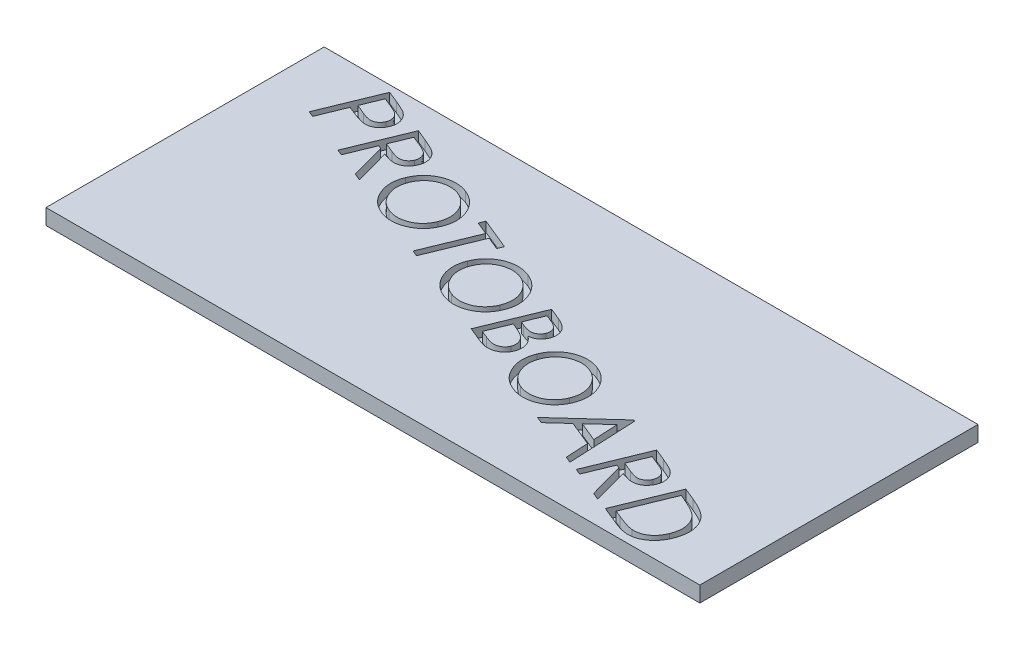
from build123d import *

# Parameters (mm, degrees)
SKETCH1_W           = 67
SKETCH1_H           = 28.5
BOSS_EXTRUDE1_DEPTH = 0.8
CUT_EXTRUDE1_DEPTH  = 1


with BuildPart() as part:
    # Sketch1 → Boss-Extrude1 (new, symmetric)
    with BuildSketch(Plane(origin=(0, 0, 0), x_dir=(1, 0, 0), z_dir=(0, 1, 0))):
        Rectangle(SKETCH1_W, SKETCH1_H)
    extrude(amount=BOSS_EXTRUDE1_DEPTH, both=True)

    # Sketch2 → Cut-Extrude1 (cut)
    # profile 1 of 10: a face of its own
    with BuildSketch(Plane(origin=(0, 0.8, 0), x_dir=(1, 0, 0), z_dir=(0, 1, 0))):
        with BuildLine():
            Line((-26.114085123, 13.586830104), (-24.948900828, 13.108544848))
            add(Edge.make_bspline(
                [(-24.948900828, 13.108544848), (-24.869114448, 13.075647807), (-24.715929476, 13.0124875), (-24.497576983, 12.919199351), (-24.301396267, 12.8292771), (-24.12559593, 12.74753227), (-23.971876498, 12.669806272), (-23.839106738, 12.598922442), (-23.727613695, 12.533683708), (-23.663044261, 12.488178388), (-23.633616373, 12.467439079)],
                knots=[0, 0, 0, 0, 1.413041787, 2.71295386, 3.88734424, 4.946346486, 5.887083026, 6.707106444, 7.410756401, 8, 8, 8, 8], degree=3))
            add(Edge.make_bspline(
                [(-23.633616373, 12.467439079), (-23.597107982, 12.439602786), (-23.524792957, 12.384465264), (-23.425777499, 12.292767117), (-23.336553974, 12.195052712), (-23.254081782, 12.093801008), (-23.183169674, 11.984333418), (-23.119125991, 11.870528143), (-23.065648057, 11.74982206), (-23.021326213, 11.624395662), (-22.986670014, 11.495271746), (-22.964749802, 11.363198666), (-22.956500351, 11.229044628), (-22.958097157, 11.092710072), (-22.975927669, 10.954557594), (-23.003744913, 10.8141324), (-23.044213364, 10.671435348), (-23.080769544, 10.577767628), (-23.099361566, 10.530129383)],
                knots=[0, 0, 0, 0, 1.010908045, 2.002384629, 2.967464651, 3.924374345, 4.875110215, 5.83674901, 6.798387805, 7.779159755, 8.764679086, 9.739741565, 10.722646018, 11.722228584, 12.738258453, 13.786034335, 14.874004436, 16, 16, 16, 16], degree=3))
            add(Edge.make_bspline(
                [(-23.099361566, 10.530129383), (-23.119855636, 10.482730008), (-23.159857643, 10.390212025), (-23.23077677, 10.259370139), (-23.307870192, 10.138848804), (-23.392136787, 10.027825025), (-23.485435569, 9.929471339), (-23.5836504, 9.839051009), (-23.689886174, 9.759986923), (-23.802743044, 9.691381333), (-23.921521695, 9.63434982), (-24.044392844, 9.587014818), (-24.171366878, 9.549338134), (-24.303363123, 9.526530979), (-24.438375638, 9.510127271), (-24.577932272, 9.507337793), (-24.72173478, 9.512776753), (-24.818382572, 9.526089409), (-24.867490572, 9.532853742)],
                knots=[0, 0, 0, 0, 1.12058794, 2.187255352, 3.226443411, 4.224288402, 5.207636086, 6.165494607, 7.119097929, 8.077310197, 9.028288897, 9.975294659, 10.933683753, 11.897758049, 12.879683058, 13.883369639, 14.924512591, 16, 16, 16, 16], degree=3))
            add(Edge.make_bspline(
                [(-24.867490572, 9.532853742), (-24.907463955, 9.53995503), (-24.994844998, 9.555478308), (-25.134246092, 9.593102841), (-25.29501604, 9.638169954), (-25.475580911, 9.69729878), (-25.676010008, 9.769316489), (-25.897905383, 9.850140814), (-26.1392454, 9.944846378), (-26.306654211, 10.012668778), (-26.39393288, 10.048028021)],
                knots=[0, 0, 0, 0, 0.603576257, 1.319406048, 2.145814691, 3.087144917, 4.144297245, 5.313491875, 6.59938763, 8, 8, 8, 8], degree=3))
            Line((-26.39393288, 10.048028021), (-26.811160444, 10.218480745))
            Line((-26.811160444, 10.218480745), (-27.926735364, 7.498869367))
            Line((-27.926735364, 7.498869367), (-28.511871582, 7.739284031))
            Line((-28.511871582, 7.739284031), (-26.114085123, 13.586830104))
        make_face()
        with BuildLine():
            Line((-25.761731357, 12.777815681), (-26.577105957, 10.790896611))
            Line((-26.577105957, 10.790896611), (-25.592550668, 10.372397011))
            add(Edge.make_bspline(
                [(-25.592550668, 10.372397011), (-25.543818791, 10.35325082), (-25.450008687, 10.316393915), (-25.313794416, 10.26411944), (-25.1846905, 10.222940966), (-25.06508472, 10.186480824), (-24.953549452, 10.160232612), (-24.851504995, 10.1389954), (-24.757573001, 10.126071135), (-24.644928239, 10.119204421), (-24.512523255, 10.126079206), (-24.361735234, 10.16015425), (-24.218664703, 10.215256596), (-24.084976092, 10.292834256), (-23.965297736, 10.391457471), (-23.857535914, 10.503274362), (-23.770309584, 10.634182056), (-23.726081216, 10.729618999), (-23.703578312, 10.778176258)],
                knots=[0, 0, 0, 0, 1.141095427, 2.196637768, 3.178462605, 4.093627622, 4.920623417, 5.674488624, 6.364487568, 6.984691394, 8.132315414, 9.239805528, 10.339753057, 11.461833926, 12.591800851, 13.709574146, 14.83465671, 16, 16, 16, 16], degree=3))
            add(Edge.make_bspline(
                [(-23.703578312, 10.778176258), (-23.685472249, 10.826906622), (-23.649633911, 10.92336134), (-23.623626563, 11.075611389), (-23.619503457, 11.22947231), (-23.63923224, 11.382663486), (-23.677800507, 11.530555792), (-23.736579359, 11.66870615), (-23.81645228, 11.793881906), (-23.90099364, 11.886713881), (-23.979890021, 11.958118452), (-24.053203186, 12.010827597), (-24.13769131, 12.065226659), (-24.232177547, 12.123041352), (-24.3403942, 12.177953478), (-24.458597598, 12.237144854), (-24.58922242, 12.29667281), (-24.681222499, 12.334598727), (-24.728838729, 12.354227941)],
                knots=[0, 0, 0, 0, 1.160691685, 2.297421559, 3.435891004, 4.592273535, 5.740224324, 6.844848026, 7.936694453, 9.044895366, 9.642706144, 10.314217422, 11.061311598, 11.89084748, 12.790205491, 13.774242598, 14.848020821, 16, 16, 16, 16], degree=3))
            Line((-24.728838729, 12.354227941), (-25.761731357, 12.777815681))
        make_face(mode=Mode.SUBTRACT)
    # profile 2 of 10: a face of its own
    with BuildSketch(Plane(origin=(0, 0.8, 0), x_dir=(1, 0, 0), z_dir=(0, 1, 0))):
        with BuildLine():
            Line((-21.237185999, 11.647023828), (-20.072001705, 11.168738572))
            add(Edge.make_bspline(
                [(-20.072001705, 11.168738572), (-19.994356534, 11.136639901), (-19.845090939, 11.074933203), (-19.63210157, 10.984543568), (-19.440763415, 10.896774652), (-19.269055863, 10.817908151), (-19.11833854, 10.742239732), (-18.988174558, 10.673356084), (-18.87840118, 10.609641556), (-18.814191883, 10.56651868), (-18.784702025, 10.546713331)],
                knots=[0, 0, 0, 0, 1.408253262, 2.707235473, 3.877690773, 4.93644646, 5.874040804, 6.703871718, 7.404717994, 8, 8, 8, 8], degree=3))
            add(Edge.make_bspline(
                [(-18.784702025, 10.546713331), (-18.746502518, 10.518462034), (-18.671341566, 10.462875075), (-18.567732031, 10.370324538), (-18.473260113, 10.272155975), (-18.387633997, 10.167881166), (-18.312603984, 10.056984442), (-18.247410468, 9.940250248), (-18.19094928, 9.817998819), (-18.14592211, 9.689630547), (-18.109446598, 9.55859164), (-18.088408129, 9.424577971), (-18.077754221, 9.289719977), (-18.080470394, 9.152557901), (-18.096185062, 9.014363957), (-18.122686779, 8.87413478), (-18.163835815, 8.733155133), (-18.19933922, 8.640124857), (-18.217374301, 8.592867177)],
                knots=[0, 0, 0, 0, 1.031596047, 2.02975762, 3.013365459, 3.988658774, 4.956837365, 5.917627858, 6.890264702, 7.877831776, 8.869812723, 9.840397818, 10.8194674, 11.805142911, 12.815132457, 13.837518562, 14.901498957, 16, 16, 16, 16], degree=3))
            add(Edge.make_bspline(
                [(-18.217374301, 8.592867177), (-18.251835253, 8.516757685), (-18.31917837, 8.368025566), (-18.452247684, 8.166740348), (-18.605949508, 7.990004006), (-18.781555193, 7.840747252), (-18.976952193, 7.721407144), (-19.188226298, 7.632628611), (-19.415411504, 7.578094576), (-19.614499562, 7.559399426), (-19.781791302, 7.560900522), (-19.916523938, 7.572837671), (-20.0586344, 7.59505382), (-20.209065454, 7.625377072), (-20.366325894, 7.666592121), (-20.531412715, 7.716552507), (-20.704224965, 7.776121772), (-20.820983611, 7.822392148), (-20.881016128, 7.846182482)],
                knots=[0, 0, 0, 0, 1.273303662, 2.488272424, 3.666698826, 4.837354516, 5.990352788, 7.147573616, 8.319873285, 9.541885801, 10.188965819, 10.870857056, 11.603850976, 12.382999543, 13.211624861, 14.083628126, 15.014680029, 16, 16, 16, 16], degree=3))
            Line((-20.881016128, 7.846182482), (-19.893916769, 4.2641312))
            Line((-19.893916769, 4.2641312), (-20.61770483, 4.56178745))
            Line((-20.61770483, 4.56178745), (-21.600988083, 8.141294661))
            Line((-21.600988083, 8.141294661), (-21.93426132, 8.278674469))
            Line((-21.93426132, 8.278674469), (-23.04983624, 5.559063091))
            Line((-23.04983624, 5.559063091), (-23.634972458, 5.799477754))
            Line((-23.634972458, 5.799477754), (-21.237185999, 11.647023828))
        make_face()
        with BuildLine():
            Line((-20.886104269, 10.834193299), (-21.701478868, 8.846002193))
            Line((-21.701478868, 8.846002193), (-20.700387121, 8.426230559))
            add(Edge.make_bspline(
                [(-20.700387121, 8.426230559), (-20.652963057, 8.407403254), (-20.561395456, 8.37105101), (-20.42764314, 8.321139402), (-20.30199797, 8.278241634), (-20.183296961, 8.246550066), (-20.07412321, 8.216863733), (-19.971982055, 8.197945213), (-19.878055833, 8.186583595), (-19.765029882, 8.178993482), (-19.631902339, 8.188185117), (-19.479900284, 8.221045915), (-19.336762651, 8.277755814), (-19.204569397, 8.357492196), (-19.083935048, 8.454871599), (-18.979112161, 8.56892543), (-18.89020016, 8.697947859), (-18.847280071, 8.793493936), (-18.825407153, 8.842186088)],
                knots=[0, 0, 0, 0, 1.118357708, 2.159353794, 3.1292168, 4.026688732, 4.851699398, 5.608165368, 6.300979365, 6.924777184, 8.088887362, 9.211869588, 10.321582219, 11.446869577, 12.5833845, 13.708096018, 14.832000864, 16, 16, 16, 16], degree=3))
            add(Edge.make_bspline(
                [(-18.825407153, 8.842186088), (-18.807170409, 8.890893786), (-18.771245819, 8.986843159), (-18.747150271, 9.138476315), (-18.742434529, 9.290515634), (-18.762440861, 9.441587333), (-18.800761283, 9.587666972), (-18.861498247, 9.723840554), (-18.940813472, 9.848557047), (-19.024145102, 9.942170899), (-19.10284324, 10.0128766), (-19.175562133, 10.066120104), (-19.258958062, 10.122378103), (-19.356153971, 10.177480045), (-19.464306048, 10.23477104), (-19.584327286, 10.293397758), (-19.716390927, 10.352882944), (-19.809022029, 10.391740048), (-19.857027746, 10.411877594)],
                knots=[0, 0, 0, 0, 1.162541698, 2.290092736, 3.420880367, 4.560253967, 5.69167983, 6.793159606, 7.886746315, 8.990394965, 9.589158587, 10.254116509, 11.007629044, 11.841847194, 12.755470124, 13.74959935, 14.833738407, 16, 16, 16, 16], degree=3))
            Line((-19.857027746, 10.411877594), (-20.886104269, 10.834193299))
        make_face(mode=Mode.SUBTRACT)
    # profile 3 of 10: a face of its own
    with BuildSketch(Plane(origin=(0, 0.8, 0), x_dir=(1, 0, 0), z_dir=(0, 1, 0))):
        with BuildLine():
            add(Edge.make_bspline(
                [(-13.428327738, 8.677745002), (-13.320947138, 8.630500876), (-13.109715773, 8.537565641), (-12.813987858, 8.36696325), (-12.542201805, 8.176013532), (-12.296501753, 7.960789884), (-12.075982205, 7.723592726), (-11.879810177, 7.464576089), (-11.708629216, 7.183440691), (-11.565347498, 6.88257093), (-11.449912713, 6.570561857), (-11.366465637, 6.253633196), (-11.316467361, 5.93567793), (-11.299740229, 5.61595932), (-11.316494216, 5.294970981), (-11.366608523, 4.972352985), (-11.450709435, 4.648994634), (-11.530589226, 4.438235025), (-11.571156264, 4.331200531)],
                knots=[0, 0, 0, 0, 1.06676285, 2.09845887, 3.100373956, 4.084633693, 5.064627346, 6.042248829, 7.03604966, 8.054145441, 9.069679602, 10.058774061, 11.031121194, 11.993064972, 12.966567117, 13.950350396, 14.959083249, 16, 16, 16, 16], degree=3))
            add(Edge.make_bspline(
                [(-11.571156264, 4.331200531), (-11.616495052, 4.227092769), (-11.705804351, 4.022019109), (-11.875175458, 3.73675181), (-12.063300773, 3.472183263), (-12.276799416, 3.232862177), (-12.512006862, 3.015638216), (-12.772022035, 2.825180822), (-13.053274895, 2.65563433), (-13.355215463, 2.514231765), (-13.667780536, 2.39870892), (-13.985088643, 2.315157972), (-14.303475669, 2.264937355), (-14.622711774, 2.248920906), (-14.94300238, 2.263288188), (-15.263024271, 2.314777562), (-15.585091324, 2.3947909), (-15.793784187, 2.4751489), (-15.899892241, 2.51600622)],
                knots=[0, 0, 0, 0, 1.041750737, 2.05206252, 3.039635193, 4.018675178, 4.991377565, 5.974095608, 6.972992521, 8.002278499, 9.030791006, 10.028966833, 11.01024157, 11.984905554, 12.959375112, 13.948343583, 14.956853301, 16, 16, 16, 16], degree=3))
            add(Edge.make_bspline(
                [(-15.899892241, 2.51600622), (-16.005150511, 2.562410813), (-16.212156309, 2.65367224), (-16.502156499, 2.821911548), (-16.768478461, 3.011760443), (-17.010094852, 3.225809562), (-17.229063514, 3.461423587), (-17.421122538, 3.721930222), (-17.591821646, 4.00259875), (-17.733457347, 4.303853752), (-17.848737574, 4.615733085), (-17.933888167, 4.931474958), (-17.983550313, 5.248378032), (-18.001340034, 5.564933858), (-17.988238163, 5.882305836), (-17.937816425, 6.199340736), (-17.85940009, 6.517539221), (-17.780487205, 6.723772981), (-17.740527258, 6.828205739)],
                knots=[0, 0, 0, 0, 1.056900278, 2.07854913, 3.075926429, 4.059071465, 5.041103051, 6.027334407, 7.029453839, 8.056465324, 9.082566472, 10.082948213, 11.057711373, 12.0259836, 12.993667151, 13.971682929, 14.972899745, 16, 16, 16, 16], degree=3))
            add(Edge.make_bspline(
                [(-17.740527258, 6.828205739), (-17.711053645, 6.897398409), (-17.652426546, 7.035032217), (-17.546427364, 7.231180454), (-17.434027422, 7.42115964), (-17.307630324, 7.599842561), (-17.170808453, 7.77057545), (-17.022255374, 7.930968222), (-16.863776952, 8.083987003), (-16.693952665, 8.225085162), (-16.516206062, 8.356277981), (-16.332094831, 8.474178786), (-16.143008834, 8.579561052), (-15.948462391, 8.669487715), (-15.748703199, 8.74625743), (-15.544011203, 8.810125026), (-15.333453385, 8.859316429), (-15.119002466, 8.896486447), (-14.902694096, 8.918893781), (-14.686832207, 8.928649145), (-14.472735526, 8.921196881), (-14.260085553, 8.903257364), (-14.049450582, 8.867991299), (-13.840189901, 8.819980086), (-13.63266481, 8.75605567), (-13.496738127, 8.703962777), (-13.428327738, 8.677745002)],
                knots=[0, 0, 0, 0, 1.036770536, 2.062280236, 3.072264252, 4.079824105, 5.078108182, 6.087973668, 7.093069485, 8.114418547, 9.130883593, 10.138307657, 11.127816725, 12.114244767, 13.091721402, 14.077646567, 15.069192837, 16.071989109, 17.077561211, 18.066759151, 19.049696446, 20.030282234, 21.008073728, 21.992592944, 22.989694331, 24, 24, 24, 24], degree=3))
        make_face()
        with BuildLine():
            add(Edge.make_bspline(
                [(-13.635669485, 8.093880819), (-13.689676742, 8.114972271), (-13.797304062, 8.157003963), (-13.963069653, 8.206716689), (-14.131282685, 8.242827208), (-14.301467837, 8.270397505), (-14.474053096, 8.285150095), (-14.648740392, 8.289650168), (-14.825385946, 8.279494166), (-15.003101098, 8.261483642), (-15.179648137, 8.230289657), (-15.352598906, 8.190735025), (-15.519671916, 8.136964313), (-15.683543618, 8.077387253), (-15.840533628, 8.002228659), (-15.994338649, 7.920136984), (-16.141760576, 7.825385501), (-16.283961125, 7.721184982), (-16.420138022, 7.608465024), (-16.547720434, 7.486054208), (-16.665835352, 7.3543956), (-16.776784624, 7.215883628), (-16.879142704, 7.06905461), (-16.971727753, 6.913040664), (-17.057526079, 6.749457338), (-17.1065248, 6.635203761), (-17.13122237, 6.577614794)],
                knots=[0, 0, 0, 0, 0.984763592, 1.962467097, 2.936021913, 3.905972193, 4.889470292, 5.87660231, 6.871979438, 7.893420729, 8.909539259, 9.915985257, 10.904798037, 11.889561629, 12.875694338, 13.858796637, 14.849968166, 15.849896535, 16.852468096, 17.851046262, 18.850715118, 19.855354906, 20.86450416, 21.888659795, 22.935789114, 24, 24, 24, 24], degree=3))
            add(Edge.make_bspline(
                [(-17.13122237, 6.577614794), (-17.163760538, 6.49165108), (-17.227951508, 6.322062733), (-17.295579368, 6.061757773), (-17.334679187, 5.802125692), (-17.350009515, 5.543443167), (-17.334724666, 5.285640885), (-17.296128868, 5.028323414), (-17.226870327, 4.772824933), (-17.135168634, 4.520584129), (-17.020531121, 4.278029577), (-16.885235726, 4.051963879), (-16.731738332, 3.844181311), (-16.559509338, 3.65537689), (-16.36850779, 3.484903682), (-16.15909915, 3.333581622), (-15.931682599, 3.199374354), (-15.768847796, 3.128311036), (-15.686190318, 3.092238191)],
                knots=[0, 0, 0, 0, 1.049770663, 2.070976947, 3.065927644, 4.046081164, 5.026234685, 6.011607383, 7.014067958, 8.045612129, 9.075060543, 10.074660155, 11.051442905, 12.022017521, 12.98969755, 13.971430498, 14.970266586, 16, 16, 16, 16], degree=3))
            add(Edge.make_bspline(
                [(-15.686190318, 3.092238191), (-15.629640714, 3.070275369), (-15.517306909, 3.026646993), (-15.345395832, 2.97514344), (-15.172632302, 2.933708799), (-14.998762577, 2.904900339), (-14.823755287, 2.886269696), (-14.647782447, 2.88227483), (-14.470562109, 2.886390953), (-14.292984055, 2.904761759), (-14.117517828, 2.933604824), (-13.945967928, 2.973481542), (-13.779104031, 3.022655205), (-13.61707415, 3.083823066), (-13.460333694, 3.157112915), (-13.307761132, 3.239150271), (-13.160558856, 3.333067757), (-13.018477977, 3.43647191), (-12.884234255, 3.551414614), (-12.756650781, 3.67319375), (-12.637899258, 3.80386339), (-12.527141262, 3.941883735), (-12.42641303, 4.089520238), (-12.333595302, 4.244439213), (-12.249318127, 4.407734616), (-12.2001794, 4.520864657), (-12.175373011, 4.577975371)],
                knots=[0, 0, 0, 0, 1.026817813, 2.039737558, 3.03580128, 4.03313198, 5.02182043, 6.012982068, 7.01132003, 8.021437214, 9.03293117, 10.020367652, 11.001651659, 11.976374287, 12.949641651, 13.929427533, 14.907344121, 15.903899312, 16.902211459, 17.897421002, 18.888400616, 19.889651332, 20.891313789, 21.912014518, 22.945935652, 24, 24, 24, 24], degree=3))
            add(Edge.make_bspline(
                [(-12.175373011, 4.577975371), (-12.153062572, 4.635820016), (-12.109028845, 4.749986992), (-12.055417923, 4.924175646), (-12.013516542, 5.098376557), (-11.982524828, 5.272478552), (-11.964880246, 5.446812027), (-11.958550809, 5.620591971), (-11.9633379, 5.794880776), (-11.981295336, 5.968270707), (-12.01098797, 6.140176313), (-12.049647784, 6.309181195), (-12.101267121, 6.474350734), (-12.163452754, 6.635945911), (-12.237413664, 6.794071697), (-12.32310625, 6.947899149), (-12.418534216, 7.098661618), (-12.525145622, 7.244107143), (-12.640371848, 7.383313189), (-12.762264808, 7.514590818), (-12.890998607, 7.635752451), (-13.026645474, 7.746977587), (-13.168841144, 7.848835624), (-13.318463087, 7.940207056), (-13.473375581, 8.023897141), (-13.581445625, 8.07049864), (-13.635669485, 8.093880819)],
                knots=[0, 0, 0, 0, 1.05356932, 2.079411554, 3.095025388, 4.097434998, 5.082780959, 6.070811719, 7.051401867, 8.043917322, 9.03089609, 10.015134417, 10.988520597, 11.969587363, 12.95619767, 13.953021334, 14.960702468, 15.98707622, 17.015977243, 18.030746853, 19.030068566, 20.018388428, 21.010354223, 22.000459384, 22.996735765, 24, 24, 24, 24], degree=3))
        make_face(mode=Mode.SUBTRACT)
    # profile 4 of 10: a face of its own
    with BuildSketch(Plane(origin=(0, 0.8, 0), x_dir=(1, 0, 0), z_dir=(0, 1, 0))):
        Polygon((-9.978612068, 6.514480292), (-9.745829616, 7.083080052), (-6.537756699, 5.767795597), (-6.770539151, 5.199195837), (-8.074375289, 5.733450645), (-10.239379296, 0.454504331), (-10.835963831, 0.6987351), (-8.670959824, 5.977681414), align=None)
    # profile 5 of 10: a face of its own
    with BuildSketch(Plane(origin=(0, 0.8, 0), x_dir=(1, 0, 0), z_dir=(0, 1, 0))):
        with BuildLine():
            add(Edge.make_bspline(
                [(-2.838023064, 4.465027121), (-2.730642464, 4.417782995), (-2.519411099, 4.32484776), (-2.223683184, 4.154245369), (-1.951897131, 3.963295651), (-1.706197079, 3.748072003), (-1.485677531, 3.510874844), (-1.289505503, 3.251858208), (-1.118324542, 2.97072281), (-0.975042824, 2.669853049), (-0.859608039, 2.357843976), (-0.776160963, 2.040915314), (-0.726162687, 1.722960048), (-0.709435555, 1.403241439), (-0.726189542, 1.0822531), (-0.776303849, 0.759635103), (-0.860404761, 0.436276753), (-0.940284552, 0.225517143), (-0.98085159, 0.11848265)],
                knots=[0, 0, 0, 0, 1.06676285, 2.09845887, 3.100373956, 4.084633693, 5.064627346, 6.042248829, 7.03604966, 8.054145441, 9.069679602, 10.058774061, 11.031121194, 11.993064972, 12.966567117, 13.950350396, 14.959083249, 16, 16, 16, 16], degree=3))
            add(Edge.make_bspline(
                [(-0.98085159, 0.11848265), (-1.026190378, 0.014374888), (-1.115499677, -0.190698772), (-1.284870784, -0.475966072), (-1.472996099, -0.740534619), (-1.686494742, -0.979855704), (-1.921702188, -1.197079665), (-2.181717361, -1.387537059), (-2.462970221, -1.557083551), (-2.764910789, -1.698486117), (-3.077475862, -1.814008961), (-3.394783969, -1.897559909), (-3.713170995, -1.947780526), (-4.0324071, -1.963796976), (-4.352697706, -1.949429693), (-4.672719597, -1.897940319), (-4.99478665, -1.817926981), (-5.203479513, -1.737568981), (-5.309587567, -1.696711661)],
                knots=[0, 0, 0, 0, 1.041750737, 2.05206252, 3.039635193, 4.018675178, 4.991377565, 5.974095608, 6.972992521, 8.002278499, 9.030791006, 10.028966833, 11.01024157, 11.984905554, 12.959375112, 13.948343583, 14.956853301, 16, 16, 16, 16], degree=3))
            add(Edge.make_bspline(
                [(-5.309587567, -1.696711661), (-5.414845837, -1.650307068), (-5.621851635, -1.559045642), (-5.911851825, -1.390806334), (-6.178173787, -1.200957439), (-6.419790178, -0.986908319), (-6.63875884, -0.751294294), (-6.830817864, -0.490787659), (-7.001516972, -0.210119132), (-7.143152673, 0.091135871), (-7.2584329, 0.403015204), (-7.343583493, 0.718757076), (-7.393245639, 1.03566015), (-7.41103536, 1.352215977), (-7.397933489, 1.669587955), (-7.347511751, 1.986622855), (-7.269095416, 2.30482134), (-7.190182531, 2.511055099), (-7.150222584, 2.615487858)],
                knots=[0, 0, 0, 0, 1.056900278, 2.07854913, 3.075926429, 4.059071465, 5.041103051, 6.027334407, 7.029453839, 8.056465324, 9.082566472, 10.082948213, 11.057711373, 12.0259836, 12.993667151, 13.971682929, 14.972899745, 16, 16, 16, 16], degree=3))
            add(Edge.make_bspline(
                [(-7.150222584, 2.615487858), (-7.120748971, 2.684680528), (-7.062121872, 2.822314335), (-6.95612269, 3.018462572), (-6.843722748, 3.208441758), (-6.71732565, 3.387124679), (-6.580503779, 3.557857568), (-6.4319507, 3.718250341), (-6.273472278, 3.871269122), (-6.103647991, 4.012367281), (-5.925901388, 4.143560099), (-5.741790157, 4.261460905), (-5.55270416, 4.36684317), (-5.358157717, 4.456769834), (-5.158398525, 4.533539548), (-4.953706529, 4.597407145), (-4.743148711, 4.646598547), (-4.528697792, 4.683768565), (-4.312389422, 4.706175899), (-4.096527533, 4.715931264), (-3.882430852, 4.708479), (-3.669780879, 4.690539483), (-3.459145908, 4.655273418), (-3.249885227, 4.607262204), (-3.042360136, 4.543337789), (-2.906433453, 4.491244895), (-2.838023064, 4.465027121)],
                knots=[0, 0, 0, 0, 1.036770536, 2.062280236, 3.072264252, 4.079824105, 5.078108182, 6.087973668, 7.093069485, 8.114418547, 9.130883593, 10.138307657, 11.127816725, 12.114244767, 13.091721402, 14.077646567, 15.069192837, 16.071989109, 17.077561211, 18.066759151, 19.049696446, 20.030282234, 21.008073728, 21.992592944, 22.989694331, 24, 24, 24, 24], degree=3))
        make_face()
        with BuildLine():
            add(Edge.make_bspline(
                [(-3.045364811, 3.881162938), (-3.099372068, 3.90225439), (-3.206999388, 3.944286082), (-3.372764979, 3.993998808), (-3.540978011, 4.030109327), (-3.711163163, 4.057679623), (-3.883748422, 4.072432214), (-4.058435718, 4.076932287), (-4.235081272, 4.066776285), (-4.412796424, 4.04876576), (-4.589343463, 4.017571776), (-4.762294232, 3.978017143), (-4.929367242, 3.924246431), (-5.093238944, 3.864669371), (-5.250228954, 3.789510777), (-5.404033975, 3.707419103), (-5.551455902, 3.612667619), (-5.693656451, 3.508467101), (-5.829833348, 3.395747143), (-5.95741576, 3.273336326), (-6.075530678, 3.141677718), (-6.18647995, 3.003165746), (-6.28883803, 2.856336728), (-6.381423079, 2.700322783), (-6.467221405, 2.536739457), (-6.516220126, 2.422485879), (-6.540917696, 2.364896912)],
                knots=[0, 0, 0, 0, 0.984763592, 1.962467097, 2.936021913, 3.905972193, 4.889470292, 5.87660231, 6.871979438, 7.893420729, 8.909539259, 9.915985257, 10.904798037, 11.889561629, 12.875694338, 13.858796637, 14.849968166, 15.849896535, 16.852468096, 17.851046262, 18.850715118, 19.855354906, 20.86450416, 21.888659795, 22.935789114, 24, 24, 24, 24], degree=3))
            add(Edge.make_bspline(
                [(-6.540917696, 2.364896912), (-6.573455864, 2.278933198), (-6.637646834, 2.109344852), (-6.705274694, 1.849039892), (-6.744374513, 1.589407811), (-6.759704841, 1.330725286), (-6.744419992, 1.072923004), (-6.705824194, 0.815605533), (-6.636565653, 0.560107052), (-6.54486396, 0.307866248), (-6.430226447, 0.065311696), (-6.294931052, -0.160754003), (-6.141433658, -0.36853657), (-5.969204664, -0.557340992), (-5.778203116, -0.7278142), (-5.568794476, -0.87913626), (-5.341377925, -1.013343527), (-5.178543122, -1.084406845), (-5.095885644, -1.12047969)],
                knots=[0, 0, 0, 0, 1.049770663, 2.070976947, 3.065927644, 4.046081164, 5.026234685, 6.011607383, 7.014067958, 8.045612129, 9.075060543, 10.074660155, 11.051442905, 12.022017521, 12.98969755, 13.971430498, 14.970266586, 16, 16, 16, 16], degree=3))
            add(Edge.make_bspline(
                [(-5.095885644, -1.12047969), (-5.03933604, -1.142442512), (-4.927002235, -1.186070888), (-4.755091158, -1.237574441), (-4.582327628, -1.279009083), (-4.408457903, -1.307817543), (-4.233450613, -1.326448185), (-4.057477773, -1.330443051), (-3.880257435, -1.326326929), (-3.702679381, -1.307956122), (-3.527213154, -1.279113058), (-3.355663254, -1.239236339), (-3.188799357, -1.190062676), (-3.026769476, -1.128894815), (-2.87002902, -1.055604966), (-2.717456458, -0.97356761), (-2.570254182, -0.879650124), (-2.428173303, -0.776245971), (-2.293929581, -0.661303267), (-2.166346107, -0.539524132), (-2.047594584, -0.408854492), (-1.936836588, -0.270834146), (-1.836108356, -0.123197643), (-1.743290628, 0.031721331), (-1.659013453, 0.195016735), (-1.609874726, 0.308146775), (-1.585068337, 0.365257489)],
                knots=[0, 0, 0, 0, 1.026817813, 2.039737558, 3.03580128, 4.03313198, 5.02182043, 6.012982068, 7.01132003, 8.021437214, 9.03293117, 10.020367652, 11.001651659, 11.976374287, 12.949641651, 13.929427533, 14.907344121, 15.903899312, 16.902211459, 17.897421002, 18.888400616, 19.889651332, 20.891313789, 21.912014518, 22.945935652, 24, 24, 24, 24], degree=3))
            add(Edge.make_bspline(
                [(-1.585068337, 0.365257489), (-1.562757898, 0.423102135), (-1.518724171, 0.537269111), (-1.465113249, 0.711457764), (-1.423211868, 0.885658676), (-1.392220154, 1.05976067), (-1.374575572, 1.234094145), (-1.368246135, 1.40787409), (-1.373033226, 1.582162895), (-1.390990662, 1.755552825), (-1.420683296, 1.927458431), (-1.45934311, 2.096463314), (-1.510962447, 2.261632853), (-1.57314808, 2.42322803), (-1.64710899, 2.581353815), (-1.732801576, 2.735181268), (-1.828229542, 2.885943736), (-1.934840948, 3.031389262), (-2.050067174, 3.170595308), (-2.171960134, 3.301872937), (-2.300693933, 3.42303457), (-2.4363408, 3.534259705), (-2.57853647, 3.636117743), (-2.728158413, 3.727489174), (-2.883070907, 3.811179259), (-2.991140951, 3.857780759), (-3.045364811, 3.881162938)],
                knots=[0, 0, 0, 0, 1.05356932, 2.079411554, 3.095025388, 4.097434998, 5.082780959, 6.070811719, 7.051401867, 8.043917322, 9.03089609, 10.015134417, 10.988520597, 11.969587363, 12.95619767, 13.953021334, 14.960702468, 15.98707622, 17.015977243, 18.030746853, 19.030068566, 20.018388428, 21.010354223, 22.000459384, 22.996735765, 24, 24, 24, 24], degree=3))
        make_face(mode=Mode.SUBTRACT)
    # profile 6 of 10: a face of its own
    with BuildSketch(Plane(origin=(0, 0.8, 0), x_dir=(1, 0, 0), z_dir=(0, 1, 0))):
        with BuildLine():
            Line((1.441059593, 2.624859366), (2.593523536, 2.152934286))
            add(Edge.make_bspline(
                [(2.593523536, 2.152934286), (2.649739984, 2.12974672), (2.758917837, 2.084714194), (2.913825451, 2.009962824), (3.058056972, 1.936570785), (3.190278198, 1.862440267), (3.308765487, 1.785187526), (3.416842097, 1.709340573), (3.51169374, 1.63066156), (3.621904002, 1.526351988), (3.737030739, 1.386368122), (3.850707683, 1.205677323), (3.930580719, 1.008131831), (3.98228757, 0.800402287), (4.005494679, 0.58674781), (3.997871142, 0.372117237), (3.95866755, 0.158387482), (3.908712948, 0.021676753), (3.883367286, -0.047686708)],
                knots=[0, 0, 0, 0, 1.008187456, 1.957998841, 2.851072544, 3.69179412, 4.469974097, 5.195790603, 5.879988591, 6.511584914, 7.709822656, 8.874755552, 10.038159663, 11.226766029, 12.414769142, 13.589737918, 14.777095835, 16, 16, 16, 16], degree=3))
            add(Edge.make_bspline(
                [(3.883367286, -0.047686708), (3.855020986, -0.110540443), (3.799217223, -0.234277054), (3.685936292, -0.401731928), (3.555828274, -0.552915719), (3.403601203, -0.682635371), (3.23354455, -0.791049632), (3.047440976, -0.877467343), (2.844088667, -0.93762416), (2.701993935, -0.958127806), (2.629140523, -0.968640233)],
                knots=[0, 0, 0, 0, 1.008833855, 1.98603444, 2.95056746, 3.924502619, 4.905331826, 5.897901348, 6.922232674, 8, 8, 8, 8], degree=3))
            add(Edge.make_bspline(
                [(2.629140523, -0.968640233), (2.690754478, -1.0240345), (2.808186179, -1.129611928), (2.960715432, -1.296027471), (3.088362615, -1.45555254), (3.183858998, -1.616544627), (3.25595111, -1.776976978), (3.310922854, -1.940316581), (3.344421092, -2.109651305), (3.360879955, -2.283075814), (3.360383442, -2.458891683), (3.337762624, -2.634878659), (3.298048977, -2.810715851), (3.255098779, -2.92377112), (3.233357269, -2.981000009)],
                knots=[0, 0, 0, 0, 1.316301892, 2.508775338, 3.58468612, 4.557994374, 5.475065921, 6.376674694, 7.29141493, 8.212268435, 9.142448519, 10.079635342, 11.027906105, 12, 12, 12, 12], degree=3))
            add(Edge.make_bspline(
                [(3.233357269, -2.981000009), (3.208204444, -3.037958664), (3.158769501, -3.149904252), (3.065914141, -3.306246198), (2.959991467, -3.449641167), (2.840104969, -3.579689328), (2.707068225, -3.696123196), (2.560654365, -3.798660461), (2.400927529, -3.887327521), (2.230376049, -3.963935906), (2.049925272, -4.022140734), (1.863223741, -4.061718534), (1.671847647, -4.082311593), (1.475291662, -4.082041365), (1.274368192, -4.060988103), (1.068689864, -4.021463208), (0.858714646, -3.960932734), (0.719868375, -3.907673436), (0.648581628, -3.880328935)],
                knots=[0, 0, 0, 0, 0.97392292, 1.91413183, 2.839345928, 3.759954152, 4.677134817, 5.601467701, 6.552321836, 7.532826001, 8.523498049, 9.514103398, 10.515302103, 11.530764269, 12.584774575, 13.672960501, 14.805246451, 16, 16, 16, 16], degree=3))
            Line((0.648581628, -3.880328935), (-0.956726865, -3.222686708))
            Line((-0.956726865, -3.222686708), (1.441059593, 2.624859366))
        make_face()
        with BuildLine():
            Line((1.779420971, 1.818389014), (1.011111677, -0.054046884))
            Line((1.011111677, -0.054046884), (1.344384914, -0.191426692))
            add(Edge.make_bspline(
                [(1.344384914, -0.191426692), (1.393451551, -0.21123807), (1.488541132, -0.249631891), (1.62821751, -0.300238124), (1.759221611, -0.343748559), (1.881374994, -0.379563754), (1.994643649, -0.407822069), (2.099050098, -0.428433013), (2.195043504, -0.44169418), (2.310663911, -0.448374851), (2.447310264, -0.441707576), (2.602721248, -0.407034562), (2.751370066, -0.35456938), (2.887632435, -0.275601509), (3.013084147, -0.181186685), (3.120160309, -0.068183699), (3.210311328, 0.059266444), (3.253471468, 0.153764023), (3.275334433, 0.201632203)],
                knots=[0, 0, 0, 0, 1.135506801, 2.200576001, 3.187567718, 4.097517745, 4.931748892, 5.69197933, 6.380481459, 7.009401107, 8.175877542, 9.302048695, 10.416096614, 11.544764823, 12.667696248, 13.774698233, 14.87276325, 16, 16, 16, 16], degree=3))
            add(Edge.make_bspline(
                [(3.275334433, 0.201632203), (3.287963359, 0.234461451), (3.31267812, 0.298708163), (3.336286124, 0.397500245), (3.350940336, 0.494101018), (3.353713523, 0.588978576), (3.344283322, 0.681515597), (3.325514187, 0.772647929), (3.294376002, 0.861573255), (3.253802543, 0.94927509), (3.199461201, 1.033558329), (3.132757072, 1.115725598), (3.051841456, 1.194188699), (2.958902767, 1.270682174), (2.852172533, 1.343314156), (2.732136866, 1.413034275), (2.598918916, 1.480540652), (2.503901575, 1.520477514), (2.454871693, 1.541085328)],
                knots=[0, 0, 0, 0, 0.944929554, 1.849223476, 2.724811581, 3.568874008, 4.393694908, 5.221112435, 6.064866754, 6.921769695, 7.813759725, 8.753999773, 9.76184351, 10.839265167, 11.987314188, 13.229094992, 14.570185766, 16, 16, 16, 16], degree=3))
            Line((2.454871693, 1.541085328), (1.779420971, 1.818389014))
        make_face(mode=Mode.SUBTRACT)
        with BuildLine():
            Line((0.770697013, -0.641727172), (-0.148984477, -2.884325329))
            Line((-0.148984477, -2.884325329), (0.574803584, -3.180709544))
            add(Edge.make_bspline(
                [(0.574803584, -3.180709544), (0.626426685, -3.20133864), (0.726257636, -3.241232064), (0.872643627, -3.294542996), (1.00979316, -3.340868437), (1.137969376, -3.377856403), (1.257293539, -3.406078204), (1.367144519, -3.426959741), (1.468348677, -3.438474827), (1.590047462, -3.444182496), (1.733724098, -3.431355263), (1.899317549, -3.394743386), (2.056734345, -3.332584186), (2.205190101, -3.249157153), (2.339077867, -3.145526055), (2.454762305, -3.026131965), (2.551594797, -2.892553426), (2.597234481, -2.793201479), (2.620236276, -2.743129416)],
                knots=[0, 0, 0, 0, 1.126631001, 2.178726965, 3.157025776, 4.060036476, 4.881287178, 5.641458004, 6.324734167, 6.944001522, 8.107965981, 9.235808959, 10.370441122, 11.524817598, 12.67647205, 13.788622306, 14.885495001, 16, 16, 16, 16], degree=3))
            add(Edge.make_bspline(
                [(2.620236276, -2.743129416), (2.642959957, -2.678466196), (2.687560131, -2.551550546), (2.713140688, -2.351862247), (2.699714142, -2.152143908), (2.64910749, -1.95484223), (2.565307478, -1.76344367), (2.445583521, -1.58422807), (2.292549515, -1.41824898), (2.170605627, -1.323929014), (2.107606068, -1.27520073)],
                knots=[0, 0, 0, 0, 0.974366421, 1.912406296, 2.844593363, 3.810044096, 4.799939543, 5.806810614, 6.866938164, 8, 8, 8, 8], degree=3))
            add(Edge.make_bspline(
                [(2.107606068, -1.27520073), (2.083236181, -1.257899834), (2.030630167, -1.220553284), (1.940641019, -1.167923966), (1.83653109, -1.11105219), (1.718172049, -1.04955714), (1.58439142, -0.986765743), (1.436533076, -0.919056411), (1.273927356, -0.847660447), (1.159625424, -0.800894977), (1.100154144, -0.77656291)],
                knots=[0, 0, 0, 0, 0.636624206, 1.374247725, 2.219422388, 3.165079744, 4.215918056, 5.368294295, 6.630723892, 8, 8, 8, 8], degree=3))
            Line((1.100154144, -0.77656291), (0.770697013, -0.641727172))
        make_face(mode=Mode.SUBTRACT)
    # profile 7 of 10: a face of its own
    with BuildSketch(Plane(origin=(0, 0.8, 0), x_dir=(1, 0, 0), z_dir=(0, 1, 0))):
        with BuildLine():
            add(Edge.make_bspline(
                [(8.962602144, -0.229144233), (9.069982744, -0.276388359), (9.281214109, -0.369323594), (9.576942025, -0.539925985), (9.848728078, -0.730875703), (10.09442813, -0.946099351), (10.314947677, -1.183296509), (10.511119705, -1.442313146), (10.682300666, -1.723448544), (10.825582384, -2.024318305), (10.941017169, -2.336327378), (11.024464245, -2.653256039), (11.074462521, -2.971211305), (11.091189653, -3.290929915), (11.074435666, -3.611918254), (11.024321359, -3.93453625), (10.940220447, -4.257894601), (10.860340656, -4.46865421), (10.819773618, -4.575688704)],
                knots=[0, 0, 0, 0, 1.06676285, 2.09845887, 3.100373956, 4.084633693, 5.064627346, 6.042248829, 7.03604966, 8.054145441, 9.069679602, 10.058774061, 11.031121194, 11.993064972, 12.966567117, 13.950350396, 14.959083249, 16, 16, 16, 16], degree=3))
            add(Edge.make_bspline(
                [(10.819773618, -4.575688704), (10.77443483, -4.679796466), (10.685125531, -4.884870126), (10.515754424, -5.170137425), (10.327629109, -5.434705972), (10.114130466, -5.674027058), (9.87892302, -5.891251019), (9.618907847, -6.081708413), (9.337654987, -6.251254905), (9.03571442, -6.39265747), (8.723149346, -6.508180315), (8.405841239, -6.591731263), (8.087454213, -6.64195188), (7.768218108, -6.657968329), (7.447927503, -6.643601046), (7.127905611, -6.592111673), (6.805838558, -6.512098334), (6.597145695, -6.431740335), (6.491037641, -6.390883015)],
                knots=[0, 0, 0, 0, 1.041750737, 2.05206252, 3.039635193, 4.018675178, 4.991377565, 5.974095608, 6.972992521, 8.002278499, 9.030791006, 10.028966833, 11.01024157, 11.984905554, 12.959375112, 13.948343583, 14.956853301, 16, 16, 16, 16], degree=3))
            add(Edge.make_bspline(
                [(6.491037641, -6.390883015), (6.385779371, -6.344478422), (6.178773573, -6.253216995), (5.888773383, -6.084977687), (5.622451421, -5.895128792), (5.380835031, -5.681079673), (5.161866368, -5.445465648), (4.969807344, -5.184959013), (4.799108236, -4.904290485), (4.657472535, -4.603035483), (4.542192308, -4.291156149), (4.457041715, -3.975414277), (4.407379569, -3.658511203), (4.389589848, -3.341955377), (4.402691719, -3.024583399), (4.453113457, -2.707548499), (4.531529793, -2.389350014), (4.610442677, -2.183116254), (4.650402625, -2.078683496)],
                knots=[0, 0, 0, 0, 1.056900278, 2.07854913, 3.075926429, 4.059071465, 5.041103051, 6.027334407, 7.029453839, 8.056465324, 9.082566472, 10.082948213, 11.057711373, 12.0259836, 12.993667151, 13.971682929, 14.972899745, 16, 16, 16, 16], degree=3))
            add(Edge.make_bspline(
                [(4.650402625, -2.078683496), (4.679876237, -2.009490825), (4.738503336, -1.871857018), (4.844502518, -1.675708781), (4.95690246, -1.485729595), (5.083299558, -1.307046674), (5.220121429, -1.136313785), (5.368674508, -0.975921013), (5.52715293, -0.822902231), (5.696977217, -0.681804073), (5.87472382, -0.550611254), (6.058835051, -0.432710449), (6.247921048, -0.327328183), (6.442467491, -0.23740152), (6.642226683, -0.160631805), (6.846918679, -0.096764209), (7.057476497, -0.047572806), (7.271927416, -0.010402788), (7.488235786, 0.012004546), (7.704097675, 0.02175991), (7.918194356, 0.014307646), (8.130844329, -0.003631871), (8.3414793, -0.038897936), (8.550739981, -0.086909149), (8.758265073, -0.150833565), (8.894191755, -0.202926458), (8.962602144, -0.229144233)],
                knots=[0, 0, 0, 0, 1.036770536, 2.062280236, 3.072264252, 4.079824105, 5.078108182, 6.087973668, 7.093069485, 8.114418547, 9.130883593, 10.138307657, 11.127816725, 12.114244767, 13.091721402, 14.077646567, 15.069192837, 16.071989109, 17.077561211, 18.066759151, 19.049696446, 20.030282234, 21.008073728, 21.992592944, 22.989694331, 24, 24, 24, 24], degree=3))
        make_face()
        with BuildLine():
            add(Edge.make_bspline(
                [(8.755260397, -0.813008415), (8.70125314, -0.791916964), (8.59362582, -0.749885272), (8.427860229, -0.700172546), (8.259647197, -0.664062026), (8.089462045, -0.63649173), (7.916876786, -0.62173914), (7.74218949, -0.617239067), (7.565543937, -0.627395069), (7.387828785, -0.645405593), (7.211281745, -0.676599578), (7.038330976, -0.71615421), (6.871257966, -0.769924922), (6.707386264, -0.829501982), (6.550396254, -0.904660576), (6.396591233, -0.986752251), (6.249169307, -1.081503734), (6.106968757, -1.185704253), (5.970791861, -1.298424211), (5.843209448, -1.420835027), (5.72509453, -1.552493635), (5.614145258, -1.691005607), (5.511787178, -1.837834625), (5.419202129, -1.993848571), (5.333403803, -2.157431896), (5.284405082, -2.271685474), (5.259707512, -2.329274441)],
                knots=[0, 0, 0, 0, 0.984763592, 1.962467097, 2.936021913, 3.905972193, 4.889470292, 5.87660231, 6.871979438, 7.893420729, 8.909539259, 9.915985257, 10.904798037, 11.889561629, 12.875694338, 13.858796637, 14.849968166, 15.849896535, 16.852468096, 17.851046262, 18.850715118, 19.855354906, 20.86450416, 21.888659795, 22.935789114, 24, 24, 24, 24], degree=3))
            add(Edge.make_bspline(
                [(5.259707512, -2.329274441), (5.227169344, -2.415238155), (5.162978374, -2.584826501), (5.095350514, -2.845131461), (5.056250695, -3.104763543), (5.040920367, -3.363446068), (5.056205216, -3.62124835), (5.094801014, -3.878565821), (5.164059556, -4.134064302), (5.255761248, -4.386305106), (5.370398761, -4.628859658), (5.505694157, -4.854925356), (5.65919155, -5.062707924), (5.831420544, -5.251512345), (6.022422093, -5.421985553), (6.231830732, -5.573307613), (6.459247283, -5.70751488), (6.622082086, -5.778578199), (6.704739564, -5.814651044)],
                knots=[0, 0, 0, 0, 1.049770663, 2.070976947, 3.065927644, 4.046081164, 5.026234685, 6.011607383, 7.014067958, 8.045612129, 9.075060543, 10.074660155, 11.051442905, 12.022017521, 12.98969755, 13.971430498, 14.970266586, 16, 16, 16, 16], degree=3))
            add(Edge.make_bspline(
                [(6.704739564, -5.814651044), (6.761289168, -5.836613866), (6.873622974, -5.880242242), (7.04553405, -5.931745794), (7.21829758, -5.973180436), (7.392167305, -6.001988896), (7.567174595, -6.020619539), (7.743147435, -6.024614404), (7.920367773, -6.020498282), (8.097945827, -6.002127476), (8.273412054, -5.973284411), (8.444961955, -5.933407693), (8.611825851, -5.88423403), (8.773855732, -5.823066168), (8.930596188, -5.74977632), (9.083168751, -5.667738964), (9.230371026, -5.573821478), (9.372451905, -5.470417325), (9.506695627, -5.355474621), (9.634279101, -5.233695485), (9.753030625, -5.103025845), (9.86378862, -4.9650055), (9.964516852, -4.817368997), (10.05733458, -4.662450022), (10.141611755, -4.499154619), (10.190750482, -4.386024578), (10.215556871, -4.328913864)],
                knots=[0, 0, 0, 0, 1.026817813, 2.039737558, 3.03580128, 4.03313198, 5.02182043, 6.012982068, 7.01132003, 8.021437214, 9.03293117, 10.020367652, 11.001651659, 11.976374287, 12.949641651, 13.929427533, 14.907344121, 15.903899312, 16.902211459, 17.897421002, 18.888400616, 19.889651332, 20.891313789, 21.912014518, 22.945935652, 24, 24, 24, 24], degree=3))
            add(Edge.make_bspline(
                [(10.215556871, -4.328913864), (10.23786731, -4.271069219), (10.281901037, -4.156902243), (10.33551196, -3.982713589), (10.37741334, -3.808512678), (10.408405054, -3.634410683), (10.426049637, -3.460077208), (10.432379073, -3.286297264), (10.427591982, -3.112008458), (10.409634546, -2.938618528), (10.379941912, -2.766712922), (10.341282098, -2.59770804), (10.289662761, -2.432538501), (10.227477128, -2.270943323), (10.153516218, -2.112817538), (10.067823632, -1.958990086), (9.972395666, -1.808227617), (9.865784261, -1.662782092), (9.750558034, -1.523576045), (9.628665074, -1.392298417), (9.499931275, -1.271136784), (9.364284408, -1.159911648), (9.222088738, -1.058053611), (9.072466795, -0.966682179), (8.917554301, -0.882992094), (8.809484257, -0.836390595), (8.755260397, -0.813008415)],
                knots=[0, 0, 0, 0, 1.05356932, 2.079411554, 3.095025388, 4.097434998, 5.082780959, 6.070811719, 7.051401867, 8.043917322, 9.03089609, 10.015134417, 10.988520597, 11.969587363, 12.95619767, 13.953021334, 14.960702468, 15.98707622, 17.015977243, 18.030746853, 19.030068566, 20.018388428, 21.010354223, 22.000459384, 22.996735765, 24, 24, 24, 24], degree=3))
        make_face(mode=Mode.SUBTRACT)
    # profile 8 of 10: a face of its own
    with BuildSketch(Plane(origin=(0, 0.8, 0), x_dir=(1, 0, 0), z_dir=(0, 1, 0))):
        Polygon((15.61530259, -3.042418959), (15.943487686, -10.008084023), (15.316374305, -9.749860866), (15.186626708, -7.448749087), (12.66545283, -6.415856459), (10.963469657, -7.965195401), (10.310915571, -7.698067997), (15.471562606, -2.982633302), align=None)
        Polygon((15.033982478, -4.252124487), (13.160274545, -5.959195802), (15.159913968, -6.779658542), align=None, mode=Mode.SUBTRACT)
    # profile 9 of 10: a face of its own
    with BuildSketch(Plane(origin=(0, 0.8, 0), x_dir=(1, 0, 0), z_dir=(0, 1, 0))):
        with BuildLine():
            Line((19.308551895, -4.481667489), (20.47373619, -4.959952746))
            add(Edge.make_bspline(
                [(20.47373619, -4.959952746), (20.551381361, -4.992051416), (20.700646956, -5.053758115), (20.913636325, -5.144147749), (21.10497448, -5.231916666), (21.276682032, -5.310783166), (21.427399354, -5.386451585), (21.557563337, -5.455335234), (21.667336715, -5.519049761), (21.731546012, -5.562172638), (21.76103587, -5.581977986)],
                knots=[0, 0, 0, 0, 1.408253262, 2.707235473, 3.877690773, 4.93644646, 5.874040804, 6.703871718, 7.404717994, 8, 8, 8, 8], degree=3))
            add(Edge.make_bspline(
                [(21.76103587, -5.581977986), (21.799235377, -5.610229284), (21.874396328, -5.665816242), (21.978005864, -5.75836678), (22.072477782, -5.856535342), (22.158103898, -5.960810151), (22.233133911, -6.071706875), (22.298327427, -6.188441069), (22.354788615, -6.310692498), (22.399815785, -6.43906077), (22.436291296, -6.570099677), (22.457329765, -6.704113346), (22.467983674, -6.83897134), (22.465267501, -6.976133416), (22.449552833, -7.11432736), (22.423051116, -7.254556537), (22.38190208, -7.395536184), (22.346398675, -7.48856646), (22.328363594, -7.53582414)],
                knots=[0, 0, 0, 0, 1.031596047, 2.02975762, 3.013365459, 3.988658774, 4.956837365, 5.917627858, 6.890264702, 7.877831776, 8.869812723, 9.840397818, 10.8194674, 11.805142911, 12.815132457, 13.837518562, 14.901498957, 16, 16, 16, 16], degree=3))
            add(Edge.make_bspline(
                [(22.328363594, -7.53582414), (22.293902642, -7.611933633), (22.226559525, -7.760665752), (22.093490211, -7.961950969), (21.939788387, -8.138687311), (21.764182701, -8.287944066), (21.568785701, -8.407284173), (21.357511596, -8.496062707), (21.13032639, -8.550596741), (20.931238333, -8.569291891), (20.763946593, -8.567790796), (20.629213956, -8.555853646), (20.487103494, -8.533637497), (20.336672441, -8.503314245), (20.179412001, -8.462099196), (20.01432518, -8.412138811), (19.84151293, -8.352569545), (19.724754284, -8.306299169), (19.664721767, -8.282508835)],
                knots=[0, 0, 0, 0, 1.273303662, 2.488272424, 3.666698826, 4.837354516, 5.990352788, 7.147573616, 8.319873285, 9.541885801, 10.188965819, 10.870857056, 11.603850976, 12.382999543, 13.211624861, 14.083628126, 15.014680029, 16, 16, 16, 16], degree=3))
            Line((19.664721767, -8.282508835), (20.651821126, -11.864560117))
            Line((20.651821126, -11.864560117), (19.928033065, -11.566903867))
            Line((19.928033065, -11.566903867), (18.944749812, -7.987396656))
            Line((18.944749812, -7.987396656), (18.611476575, -7.850016848))
            Line((18.611476575, -7.850016848), (17.495901655, -10.569628226))
            Line((17.495901655, -10.569628226), (16.910765437, -10.329213563))
            Line((16.910765437, -10.329213563), (19.308551895, -4.481667489))
        make_face()
        with BuildLine():
            Line((19.659633626, -5.294498018), (18.844259027, -7.282689124))
            Line((18.844259027, -7.282689124), (19.845350774, -7.702460758))
            add(Edge.make_bspline(
                [(19.845350774, -7.702460758), (19.892774838, -7.721288063), (19.984342439, -7.757640308), (20.118094755, -7.807551916), (20.243739925, -7.850449683), (20.362440933, -7.882141251), (20.471614685, -7.911827584), (20.573755839, -7.930746104), (20.667682062, -7.942107723), (20.780708012, -7.949697836), (20.913835556, -7.940506201), (21.065837611, -7.907645402), (21.208975243, -7.850935504), (21.341168498, -7.771199122), (21.461802847, -7.673819718), (21.566625733, -7.559765888), (21.655537734, -7.430743458), (21.698457824, -7.335197381), (21.720330741, -7.28650523)],
                knots=[0, 0, 0, 0, 1.118357708, 2.159353794, 3.1292168, 4.026688732, 4.851699398, 5.608165368, 6.300979365, 6.924777184, 8.088887362, 9.211869588, 10.321582219, 11.446869577, 12.5833845, 13.708096018, 14.832000864, 16, 16, 16, 16], degree=3))
            add(Edge.make_bspline(
                [(21.720330741, -7.28650523), (21.738567485, -7.237797531), (21.774492076, -7.141848159), (21.798587624, -6.990215002), (21.803303366, -6.838175683), (21.783297033, -6.687103984), (21.744976612, -6.541024345), (21.684239647, -6.404850764), (21.604924423, -6.28013427), (21.521592793, -6.186520419), (21.442894654, -6.115814718), (21.370175762, -6.062571213), (21.286779833, -6.006313214), (21.189583924, -5.951211273), (21.081431846, -5.893920277), (20.961410609, -5.835293559), (20.829346968, -5.775808373), (20.736715866, -5.73695127), (20.688710149, -5.716813723)],
                knots=[0, 0, 0, 0, 1.162541698, 2.290092736, 3.420880367, 4.560253967, 5.69167983, 6.793159606, 7.886746315, 8.990394965, 9.589158587, 10.254116509, 11.007629044, 11.841847194, 12.755470124, 13.74959935, 14.833738407, 16, 16, 16, 16], degree=3))
            Line((20.688710149, -5.716813723), (19.659633626, -5.294498018))
        make_face(mode=Mode.SUBTRACT)
    # profile 10 of 10: a face of its own
    with BuildSketch(Plane(origin=(0, 0.8, 0), x_dir=(1, 0, 0), z_dir=(0, 1, 0))):
        with BuildLine():
            Line((21.871536759, -12.302488783), (24.269323217, -6.454942709))
            Line((24.269323217, -6.454942709), (25.482844852, -6.952308495))
            add(Edge.make_bspline(
                [(25.482844852, -6.952308495), (25.588154748, -6.996459174), (25.791135248, -7.081557795), (26.082035597, -7.210532749), (26.346279328, -7.339965446), (26.587467324, -7.462762279), (26.801142344, -7.587289713), (26.991750313, -7.705761134), (27.156404998, -7.823329561), (27.253581717, -7.905723163), (27.299311198, -7.944495995)],
                knots=[0, 0, 0, 0, 1.318737046, 2.541811496, 3.674047986, 4.716536475, 5.666455929, 6.529121032, 7.307832869, 8, 8, 8, 8], degree=3))
            add(Edge.make_bspline(
                [(27.299311198, -7.944495995), (27.357818095, -7.999196699), (27.473370532, -8.107231822), (27.630664832, -8.282700823), (27.770466423, -8.467008406), (27.893862816, -8.660141105), (27.998271454, -8.862970295), (28.084528444, -9.074815974), (28.155130132, -9.295015525), (28.20803892, -9.523064226), (28.243865492, -9.756919536), (28.260471131, -9.994746138), (28.257390165, -10.234999495), (28.237208443, -10.478256919), (28.197276377, -10.723440078), (28.139536514, -10.971599944), (28.063699491, -11.222616824), (27.998819294, -11.387886463), (27.965857672, -11.471849761)],
                knots=[0, 0, 0, 0, 0.999414298, 1.973865724, 2.937142526, 3.884171957, 4.831023897, 5.780460953, 6.736205653, 7.714472902, 8.699531576, 9.686365964, 10.686732779, 11.695895514, 12.730469793, 13.784504685, 14.874443638, 16, 16, 16, 16], degree=3))
            add(Edge.make_bspline(
                [(27.965857672, -11.471849761), (27.935433406, -11.543527018), (27.875359864, -11.685055712), (27.76970777, -11.887329559), (27.657457922, -12.079564496), (27.534695677, -12.259490432), (27.403583067, -12.427904529), (27.262907072, -12.585139945), (27.113333064, -12.731450439), (26.954209683, -12.86470225), (26.78967595, -12.984628501), (26.622059202, -13.09239253), (26.452433169, -13.186659822), (26.279092919, -13.265892304), (26.103743136, -13.332378437), (25.925504221, -13.384483653), (25.744844327, -13.423022003), (25.560296474, -13.447696239), (25.368416155, -13.456107762), (25.166732282, -13.450101146), (24.954387113, -13.424615412), (24.731082693, -13.384793543), (24.496595546, -13.329928035), (24.250983874, -13.257989281), (23.994007296, -13.170588961), (23.821257373, -13.101300149), (23.732524339, -13.065709937)],
                knots=[0, 0, 0, 0, 1.087405971, 2.147112667, 3.185361629, 4.195779153, 5.187550487, 6.164996116, 7.1410048, 8.108002341, 9.061755843, 9.983556331, 10.890293549, 11.770264003, 12.643811301, 13.507928758, 14.361834599, 15.222208275, 16.105779921, 17.04215792, 18.037760445, 19.090507604, 20.209794146, 21.400177394, 22.664600577, 24, 24, 24, 24], degree=3))
            Line((23.732524339, -13.065709937), (21.871536759, -12.302488783))
        make_face()
        with BuildLine():
            Line((22.658926583, -11.980663863), (23.334377304, -12.257967549))
            add(Edge.make_bspline(
                [(23.334377304, -12.257967549), (23.431762449, -12.297325787), (23.618734606, -12.372890646), (23.890087044, -12.476114416), (24.139651329, -12.565513199), (24.368563526, -12.639248407), (24.575455441, -12.701512609), (24.761817025, -12.747375052), (24.927032065, -12.779172207), (25.030340258, -12.790688124), (25.07833764, -12.796038463)],
                knots=[0, 0, 0, 0, 1.37700215, 2.643740588, 3.805893362, 4.851841346, 5.796388716, 6.63767331, 7.367057806, 8, 8, 8, 8], degree=3))
            add(Edge.make_bspline(
                [(25.07833764, -12.796038463), (25.139805316, -12.799149905), (25.261486844, -12.805309322), (25.442320617, -12.797153006), (25.618828552, -12.77555846), (25.791376523, -12.740178919), (25.959342041, -12.688952404), (26.122732583, -12.623870864), (26.281629966, -12.544566334), (26.43470233, -12.450200982), (26.582945428, -12.343936373), (26.721188233, -12.222410783), (26.851648633, -12.089278977), (26.974160473, -11.944502421), (27.086096265, -11.785433998), (27.189856658, -11.614683205), (27.288271793, -11.432679886), (27.342768521, -11.303591062), (27.370545172, -11.237795273)],
                knots=[0, 0, 0, 0, 0.991081727, 1.961947305, 2.911749228, 3.853558701, 4.795739691, 5.73695443, 6.683976523, 7.652845448, 8.63118007, 9.618866056, 10.613941728, 11.632010817, 12.670680209, 13.743819254, 14.850038391, 16, 16, 16, 16], degree=3))
            add(Edge.make_bspline(
                [(27.370545172, -11.237795273), (27.397818566, -11.167758037), (27.45128878, -11.030448169), (27.513549816, -10.821515771), (27.560665756, -10.615441298), (27.593535487, -10.411980667), (27.606983389, -10.210635034), (27.605878326, -10.012072086), (27.589674149, -9.815443378), (27.556451302, -9.622319688), (27.508005073, -9.434429476), (27.446258861, -9.252490964), (27.366510924, -9.079380918), (27.273301411, -8.913547853), (27.166741532, -8.754421111), (27.041495974, -8.606083855), (26.904723628, -8.462140186), (26.802770792, -8.375258142), (26.751064003, -8.331194713)],
                knots=[0, 0, 0, 0, 1.126559999, 2.208650913, 3.265094471, 4.294644016, 5.295225601, 6.287023135, 7.2695674, 8.249949624, 9.221385962, 10.176394318, 11.126629459, 12.074500959, 13.026690706, 13.992912193, 14.982077687, 16, 16, 16, 16], degree=3))
            add(Edge.make_bspline(
                [(26.751064003, -8.331194713), (26.707321564, -8.297634461), (26.61383805, -8.22591166), (26.457092318, -8.122239897), (26.275351679, -8.01608044), (26.070442376, -7.903719872), (25.840096768, -7.788732567), (25.585531836, -7.669329615), (25.30688119, -7.545924403), (25.112005841, -7.464959691), (25.010919772, -7.422961539)],
                knots=[0, 0, 0, 0, 0.672032163, 1.436223726, 2.289109296, 3.237606414, 4.284881963, 5.42727816, 6.665473402, 8, 8, 8, 8], degree=3))
            Line((25.010919772, -7.422961539), (24.597508314, -7.25378085))
            Line((24.597508314, -7.25378085), (22.658926583, -11.980663863))
        make_face(mode=Mode.SUBTRACT)
    extrude(amount=-CUT_EXTRUDE1_DEPTH, mode=Mode.SUBTRACT)


solid = part.part
